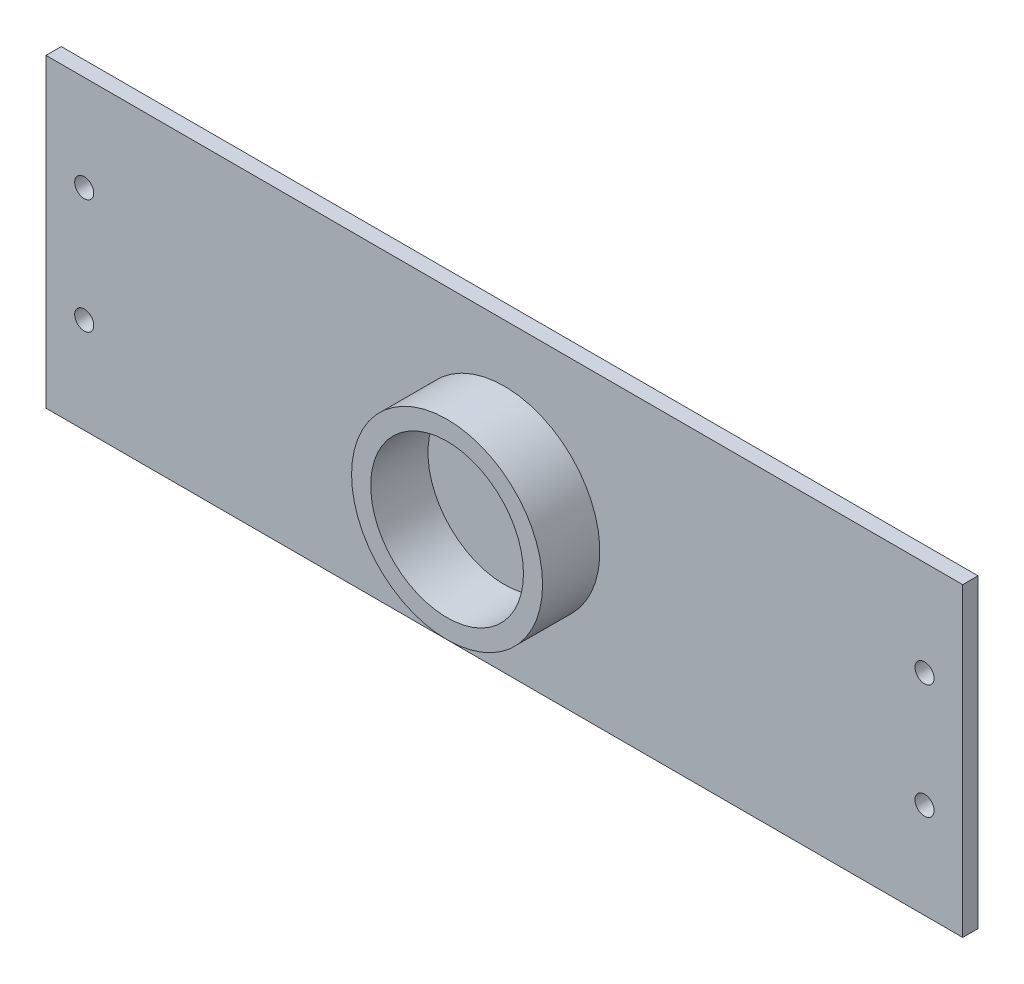
from build123d import *

# Parameters (mm, degrees)
ESQUISSE1_W        = 240
ESQUISSE1_H        = 80
ESQUISSE1_R        = 2.5
BOSS_EXTRU_1_DEPTH = 4
ESQUISSE2_R        = 25
ESQUISSE2_R_2      = 20
BOSS_EXTRU_2_DEPTH = 15


with BuildPart() as part:
    # Esquisse1 → Boss.-Extru.1 (new body)
    with BuildSketch(Plane.XY):
        with Locations((120, 40)):
            Rectangle(ESQUISSE1_W, ESQUISSE1_H)
        with Locations((10, 55)):
            Circle(ESQUISSE1_R, mode=Mode.SUBTRACT)
        with Locations((10, 25)):
            Circle(ESQUISSE1_R, mode=Mode.SUBTRACT)
        with Locations(Location((230, 25, 0), (0, 0, 180))):
            Circle(ESQUISSE1_R, mode=Mode.SUBTRACT)
        with Locations(Location((230, 55, 0), (0, 0, 180))):
            Circle(ESQUISSE1_R, mode=Mode.SUBTRACT)
    extrude(amount=BOSS_EXTRU_1_DEPTH)

    # Esquisse2 → Boss.-Extru.2 (add)
    with BuildSketch(Plane.XY.offset(4)):
        with Locations(Location((120, 40, 0), (0, 0, 180))):
            Circle(ESQUISSE2_R)
        with Locations((120, 40)):
            Circle(ESQUISSE2_R_2, mode=Mode.SUBTRACT)
    extrude(amount=BOSS_EXTRU_2_DEPTH)


solid = part.part
